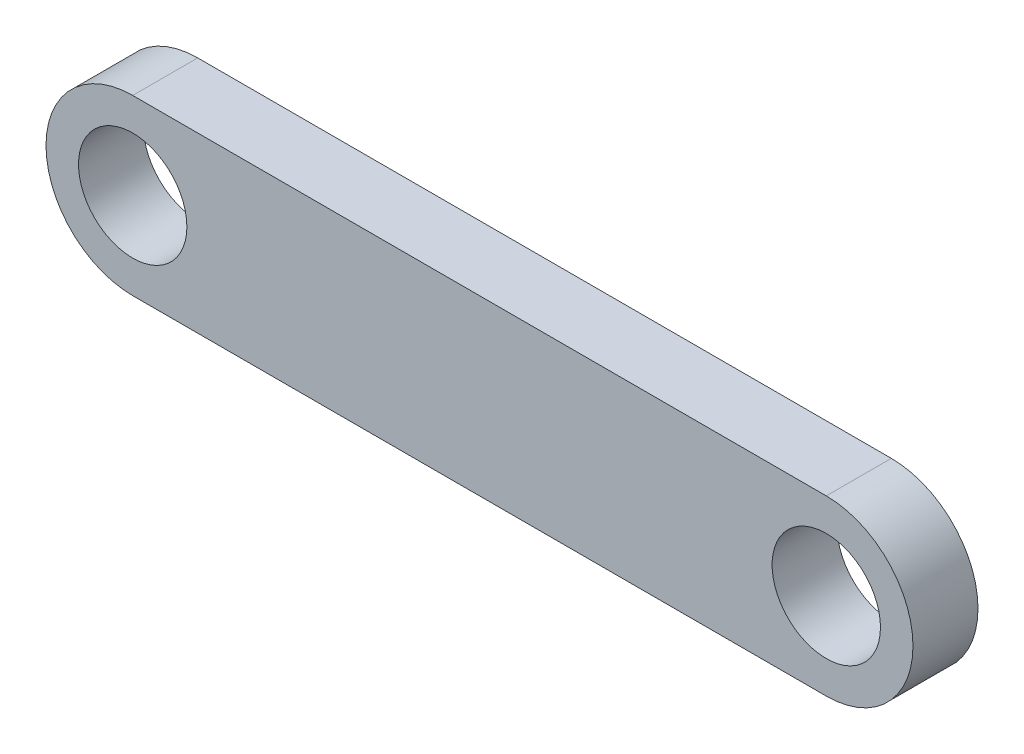
from build123d import *

# Parameters (mm, degrees)
SKETCH2_R           = 2.5
BOSS_EXTRUDE1_DEPTH = 3


with BuildPart() as part:
    # Sketch2 → Boss-Extrude1 (new body)
    with BuildSketch(Plane.XY):
        with BuildLine():
            Line((-32, 4), (0, 4))
            ThreePointArc((0, 4), (4, 0), (0, -4))
            Line((0, -4), (-32, -4))
            ThreePointArc((-32, -4), (-36, 0), (-32, 4))
        make_face()
        with Locations((-32, 0)):
            Circle(SKETCH2_R, mode=Mode.SUBTRACT)
        Circle(SKETCH2_R, mode=Mode.SUBTRACT)
    extrude(amount=BOSS_EXTRUDE1_DEPTH)


solid = part.part
